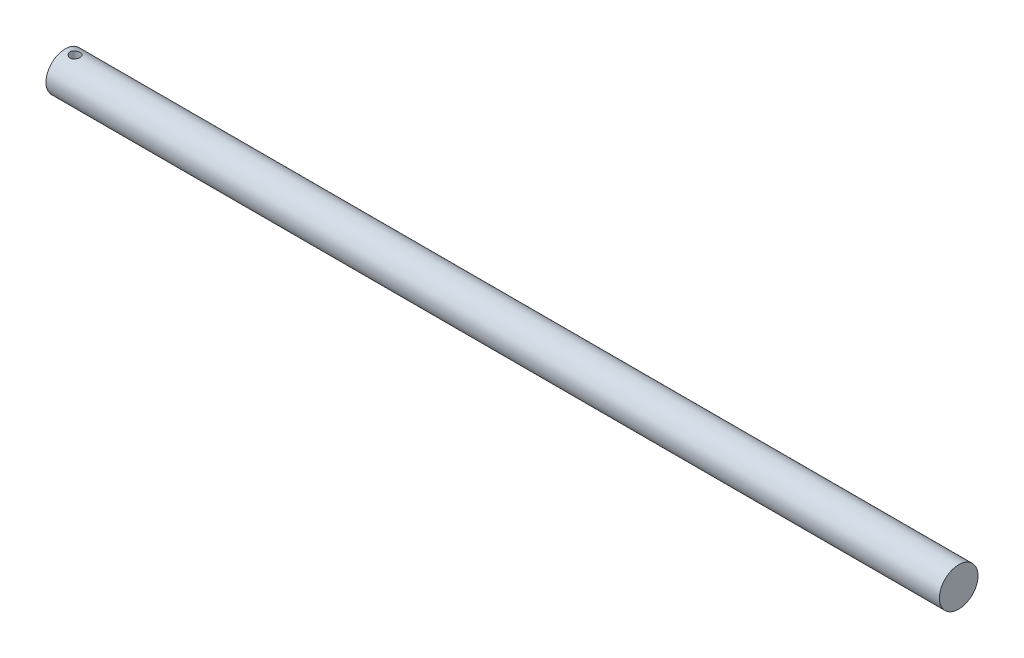
from build123d import *

# Parameters (mm, degrees)
SKETCH1_R               = 4.85
BOSS_EXTRUDE1_DEPTH     = 224.6937
CUT_EXTRUDE1_DEPTH      = 225.798362582
CUT_EXTRUDE1_DEPTH_BACK = 225.798362582
SKETCH2_R               = 1.25
SCALE1_SCALE            = 1.5


with BuildPart() as part:
    # Sketch1 → Boss-Extrude1 (new body)
    with BuildSketch(Plane(origin=(0, 0, 0), x_dir=(0, 0, -1), z_dir=(1, 0, 0))):
        with Locations(Location((0, 0, 0), (0, 0, 180))):
            Circle(SKETCH1_R)
    extrude(amount=BOSS_EXTRUDE1_DEPTH)

    # Sketch2 → Cut-Extrude1 (cut, two sides: drawn at the far end of the back side and taken through both)
    with BuildSketch(Plane(origin=(0, 0, 0), x_dir=(1, 0, 0), z_dir=(0, 1, 0)).offset(-CUT_EXTRUDE1_DEPTH_BACK)):
        with Locations(Location((2.5, 0, 0), (0, 0, 270))):
            Circle(SKETCH2_R)
    extrude(amount=CUT_EXTRUDE1_DEPTH + CUT_EXTRUDE1_DEPTH_BACK, mode=Mode.SUBTRACT)


with BuildPart() as part_1:
    # Scale1: scaled about (112.660192286, 0, 1.805e-06)
    add(part.part.scale(SCALE1_SCALE).moved(Location((-56.330096143, 0, -9.03e-07))))


solid = part_1.part
